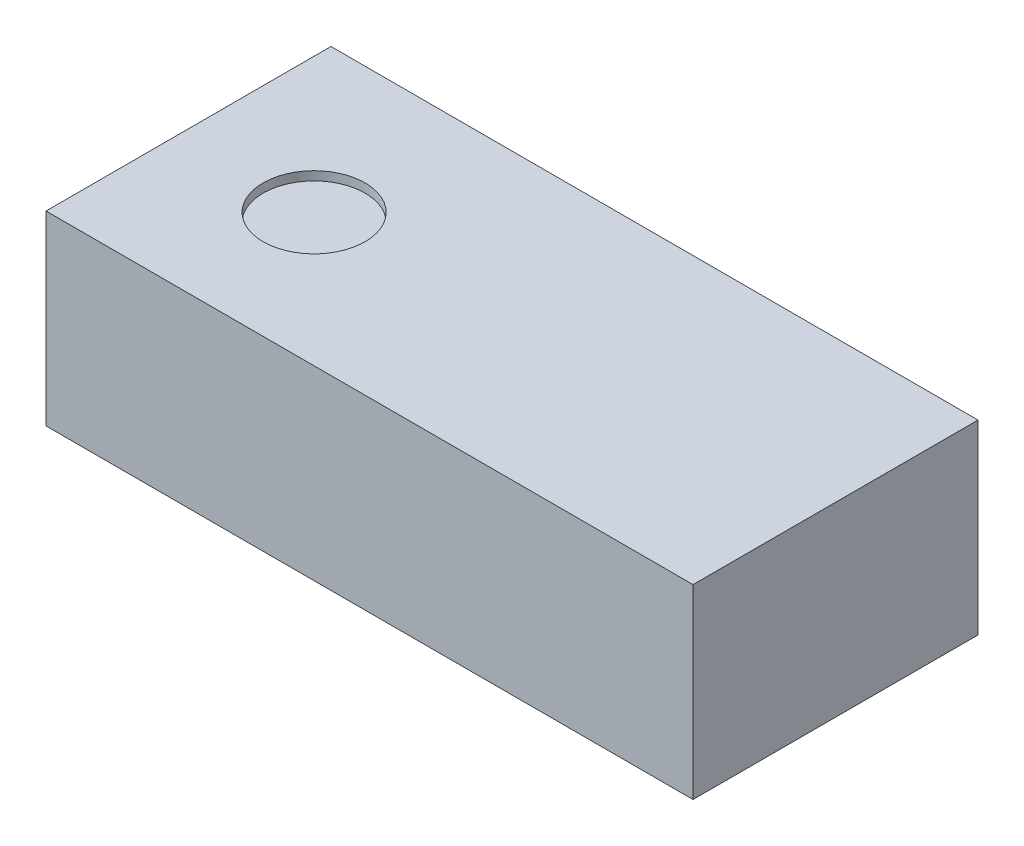
from build123d import *

# Parameters (mm, degrees)
SKETCH1_W           = 73
SKETCH1_H           = 32.15
BOSS_EXTRUDE1_DEPTH = 21
SKETCH2_R           = 5.75
CUT_EXTRUDE1_DEPTH  = 1


with BuildPart() as part:
    # Sketch1 → Boss-Extrude1 (new body)
    with BuildSketch(Plane(origin=(0, 0, 0), x_dir=(1, 0, 0), z_dir=(0, 1, 0))):
        Rectangle(SKETCH1_W, SKETCH1_H)
    extrude(amount=BOSS_EXTRUDE1_DEPTH)

    # Sketch2 → Cut-Extrude1 (cut)
    with BuildSketch(Plane(origin=(0, 21, 0), x_dir=(1, 0, 0), z_dir=(0, 1, 0))):
        with Locations(Location((-21.25, -1.075, 0), (0, 0, 270))):
            Circle(SKETCH2_R)
    extrude(amount=-CUT_EXTRUDE1_DEPTH, mode=Mode.SUBTRACT)


solid = part.part
